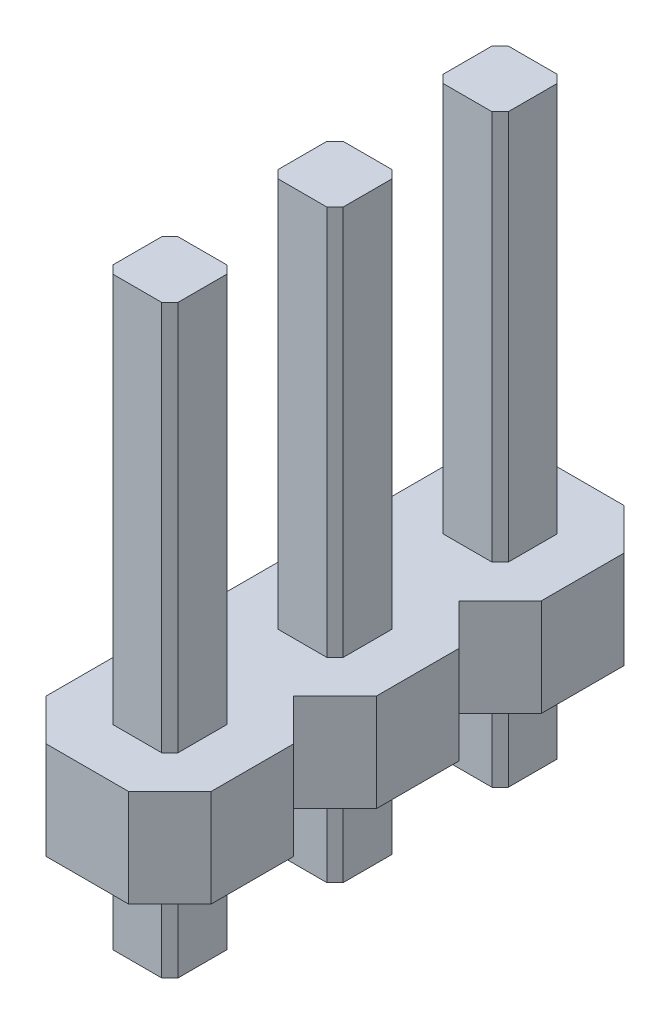
from build123d import *

# Parameters (mm, degrees)
BOSS_EXTRUDE1_DEPTH      = 1.5
BOSS_EXTRUDE2_DEPTH      = 6
BOSS_EXTRUDE2_DEPTH_BACK = 3
CUT_EXTRUDE1_DEPTH       = 13.69206445
CUT_EXTRUDE1_DEPTH_BACK  = 13.69206445


with BuildPart() as part:
    # Sketch1 → Boss-Extrude1 (new body)
    with BuildSketch(Plane(origin=(0, 0, 0), x_dir=(1, 0, 0), z_dir=(0, 1, 0))):
        Polygon((-0.635, 10.16), (0.635, 10.16), (1.27, 9.525), (1.27, 8.255), (0.635, 7.62), (1.27, 6.985), (1.27, 5.715), (0.635, 5.08), (1.27, 4.445), (1.27, 3.175), (0.635, 2.54), (1.27, 1.905), (1.27, 0.635), (0.635, 0), (1.27, -0.635), (1.27, -1.905), (0.635, -2.54), (1.27, -3.175), (1.27, -4.445), (0.635, -5.08), (-0.635, -5.08), (-1.27, -4.445), (-1.27, -3.175), (-0.635, -2.54), (-1.27, -1.905), (-1.27, -0.635), (-0.635, 0), (-1.27, 0.635), (-1.27, 1.905), (-0.635, 2.54), (-1.27, 3.175), (-1.27, 4.445), (-0.635, 5.08), (-1.27, 5.715), (-1.27, 6.985), (-0.635, 7.62), (-1.27, 8.255), (-1.27, 9.525), align=None)
    extrude(amount=BOSS_EXTRUDE1_DEPTH)

    # Sketch3 → Boss-Extrude2 (add, two sides: drawn at the far end of the back side and taken through both)
    with BuildSketch(Plane(origin=(0, 1.5, 0), x_dir=(1, 0, 0), z_dir=(0, 1, 0)).offset(-BOSS_EXTRUDE2_DEPTH_BACK)):
        Polygon((0.375, 9.39), (0.5, 9.265), (0.5, 8.515), (0.375, 8.39), (-0.375, 8.39), (-0.5, 8.515), (-0.5, 9.265), (-0.375, 9.39), align=None)
        Polygon((0.375, 6.85), (0.5, 6.725), (0.5, 5.975), (0.375, 5.85), (-0.375, 5.85), (-0.5, 5.975), (-0.5, 6.725), (-0.375, 6.85), align=None)
        Polygon((0.375, 4.31), (0.5, 4.185), (0.5, 3.435), (0.375, 3.31), (-0.375, 3.31), (-0.5, 3.435), (-0.5, 4.185), (-0.375, 4.31), align=None)
        Polygon((0.375, 1.77), (0.5, 1.645), (0.5, 0.895), (0.375, 0.77), (-0.375, 0.77), (-0.5, 0.895), (-0.5, 1.645), (-0.375, 1.77), align=None)
        Polygon((0.375, -0.77), (0.5, -0.895), (0.5, -1.645), (0.375, -1.77), (-0.375, -1.77), (-0.5, -1.645), (-0.5, -0.895), (-0.375, -0.77), align=None)
        Polygon((0.375, -3.31), (0.5, -3.435), (0.5, -4.185), (0.375, -4.31), (-0.375, -4.31), (-0.5, -4.185), (-0.5, -3.435), (-0.375, -3.31), align=None)
    extrude(amount=BOSS_EXTRUDE2_DEPTH + BOSS_EXTRUDE2_DEPTH_BACK)

    # Sketch4 → Cut-Extrude1 (cut, two sides: drawn at the far end of the back side and taken through both)
    with BuildSketch(Plane(origin=(0, 0, 0), x_dir=(1, 0, 0), z_dir=(0, 1, 0)).offset(-CUT_EXTRUDE1_DEPTH_BACK)):
        Polygon((0.635, 2.54), (-0.635, 2.54), (-3.551273802, 2.145414022), (-3.551273802, -5.54901255), (3.518391637, -6.305302341), (3.518391637, 1.323359901), align=None)
    extrude(amount=CUT_EXTRUDE1_DEPTH + CUT_EXTRUDE1_DEPTH_BACK, mode=Mode.SUBTRACT)


solid = part.part
